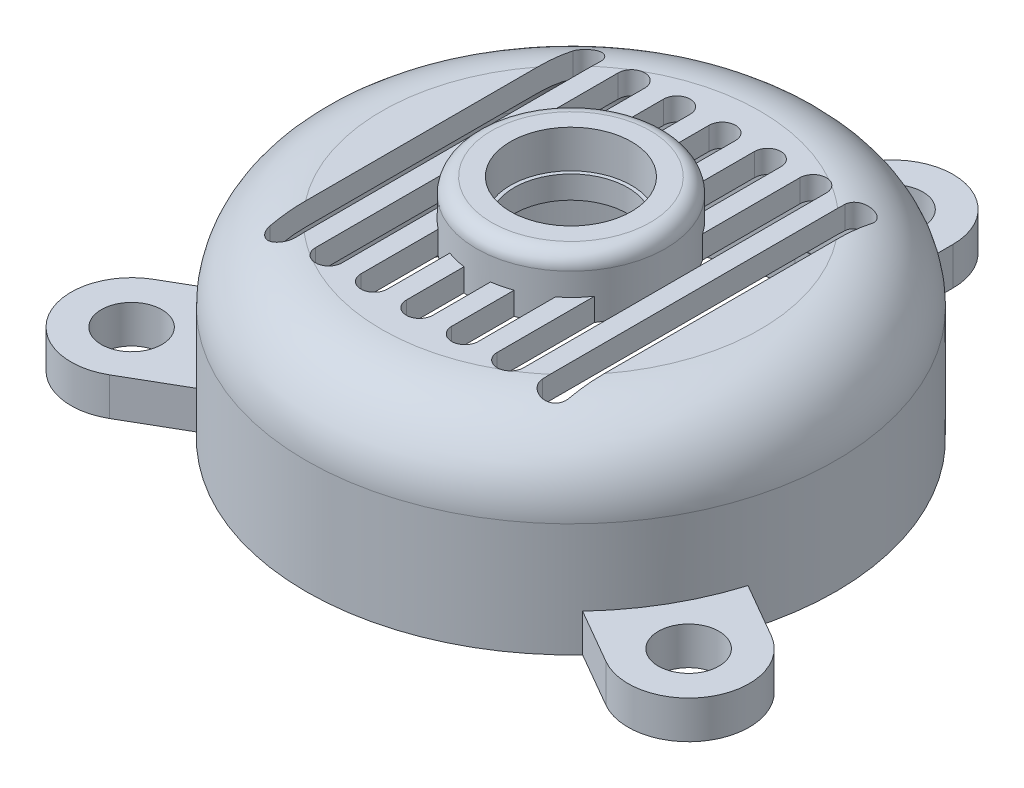
from build123d import *

# Parameters (mm, degrees)
SKETCH2_R               = 35
BOSS_EXTRUDE1_DEPTH     = 25
FILLET1_R               = 10
SHELL2_T                = -3
SKETCH3_R               = 4
BOSS_EXTRUDE2_DEPTH     = 5
SKETCH6_R               = 12.5
SKETCH6_R_2             = 7.5
BOSS_EXTRUDE3_DEPTH     = 5
FILLET2_R               = 2
CUT_EXTRUDE1_DEPTH      = 72.991907702
CUT_EXTRUDE1_DEPTH_BACK = 72.991907702
SKETCH11_R              = 8
CUT_EXTRUDE3_DEPTH      = 72.991907702
BOSS_EXTRUDE4_START     = -3
SKETCH20_R              = 12.5
SKETCH20_R_2            = 7.5
BOSS_EXTRUDE4_DEPTH     = 3


with BuildPart() as part:
    # Sketch2 → Boss-Extrude1 (new body)
    with BuildSketch(Plane(origin=(0, 0, 0), x_dir=(1, 0, 0), z_dir=(0, 1, 0))):
        with Locations(Location((0, 0, 0), (0, 0, 270))):
            Circle(SKETCH2_R)
    extrude(amount=BOSS_EXTRUDE1_DEPTH)

    # Fillet1
    fillet1_edges = [part.edges().sort_by_distance(p)[0] for p in [
        (0, 25, -35),
    ]]
    fillet(fillet1_edges, radius=FILLET1_R)

    # Shell2
    shell2_openings = [part.faces().sort_by_distance(p)[0] for p in [
        (0, 0, 0),
    ]]
    offset(amount=SHELL2_T, openings=shell2_openings, kind=Kind.INTERSECTION)

    # Sketch3 → Boss-Extrude2 (add)
    # profile 1 of 3: a face of its own
    with BuildSketch(Plane(origin=(0, 0, 0), x_dir=(1, 0, 0), z_dir=(0, 1, 0))):
        with BuildLine():
            Line((8, 42.5), (8, 31.918140877))
            Line((8, 31.918140877), (-8, 31.918140877))
            Line((-8, 31.918140877), (-8, 42.5))
            ThreePointArc((-8, 42.5), (0, 50.5), (8, 42.5))
        make_face()
        with Locations(Location((0, 42.5, 0), (0, 0, 270))):
            Circle(SKETCH3_R, mode=Mode.SUBTRACT)
    # profile 2 of 3: a face of its own
    with BuildSketch(Plane(origin=(0, 0, 0), x_dir=(1, 0, 0), z_dir=(0, 1, 0))):
        with BuildLine():
            Line((32.806079661, -28.17820323), (23.641920841, -22.887273669))
            Line((23.641920841, -22.887273669), (31.641920841, -9.030867208))
            Line((31.641920841, -9.030867208), (40.806079661, -14.32179677))
            ThreePointArc((40.806079661, -14.32179677), (43.734282891, -25.25), (32.806079661, -28.17820323))
        make_face()
        with Locations(Location((36.806079661, -21.25, 0), (0, 0, 270))):
            Circle(SKETCH3_R, mode=Mode.SUBTRACT)
    # profile 3 of 3: a face of its own
    with BuildSketch(Plane(origin=(0, 0, 0), x_dir=(1, 0, 0), z_dir=(0, 1, 0))):
        with BuildLine():
            Line((-40.806079661, -14.32179677), (-31.641920841, -9.030867208))
            Line((-31.641920841, -9.030867208), (-23.641920841, -22.887273669))
            Line((-23.641920841, -22.887273669), (-32.806079661, -28.17820323))
            ThreePointArc((-32.806079661, -28.17820323), (-43.734282891, -25.25), (-40.806079661, -14.32179677))
        make_face()
        with Locations(Location((-36.806079661, -21.25, 0), (0, 0, 270))):
            Circle(SKETCH3_R, mode=Mode.SUBTRACT)
    extrude(amount=BOSS_EXTRUDE2_DEPTH)

    # Sketch6 → Boss-Extrude3 (add)
    with BuildSketch(Plane(origin=(0, 25, 0), x_dir=(1, 0, 0), z_dir=(0, 1, 0))):
        with Locations(Location((0, 0, 0), (0, 0, 270))):
            Circle(SKETCH6_R)
        with Locations(Location((0, 0, 0), (0, 0, 270))):
            Circle(SKETCH6_R_2, mode=Mode.SUBTRACT)
    extrude(amount=BOSS_EXTRUDE3_DEPTH)

    # Fillet2
    fillet2_edges = [part.edges().sort_by_distance(p)[0] for p in [
        (0, 30, -12.5),
    ]]
    fillet(fillet2_edges, radius=FILLET2_R)

    # Sketch11 → Cut-Extrude1 (cut, two sides: drawn at the far end of the back side and taken through both)
    with BuildSketch(Plane(origin=(0, 25, 0), x_dir=(1, 0, 0), z_dir=(0, 1, 0)).offset(-CUT_EXTRUDE1_DEPTH_BACK)):
        with Locations(Location((0, 0, 0), (0, 0, 270))):
            Circle(SKETCH11_R)
    extrude(amount=CUT_EXTRUDE1_DEPTH + CUT_EXTRUDE1_DEPTH_BACK, mode=Mode.SUBTRACT)

    # Sketch18 → Cut-Extrude3 (cut, through all)
    with BuildSketch(Plane(origin=(0, 25, 0), x_dir=(1, 0, 0), z_dir=(0, 1, 0))):
        with BuildLine():
            Line((-1.75, -20), (-1.75, 20))
            ThreePointArc((-1.75, 20), (0, 21.75), (1.75, 20))
            Line((1.75, 20), (1.75, -20))
            ThreePointArc((1.75, -20), (0, -21.75), (-1.75, -20))
        make_face()
        with BuildLine():
            Line((4.25, -20), (4.25, 20))
            ThreePointArc((4.25, 20), (6, 21.75), (7.75, 20))
            Line((7.75, 20), (7.75, -20))
            ThreePointArc((7.75, -20), (6, -21.75), (4.25, -20))
        make_face()
        with BuildLine():
            Line((10.25, -20), (10.25, 20))
            ThreePointArc((10.25, 20), (12, 21.75), (13.75, 20))
            Line((13.75, 20), (13.75, -20))
            ThreePointArc((13.75, -20), (12, -21.75), (10.25, -20))
        make_face()
        with BuildLine():
            Line((16.25, -20), (16.25, 20))
            ThreePointArc((16.25, 20), (18, 21.75), (19.75, 20))
            Line((19.75, 20), (19.75, -20))
            ThreePointArc((19.75, -20), (18, -21.75), (16.25, -20))
        make_face()
        with BuildLine():
            Line((-7.75, -20), (-7.75, 20))
            ThreePointArc((-7.75, 20), (-6, 21.75), (-4.25, 20))
            Line((-4.25, 20), (-4.25, -20))
            ThreePointArc((-4.25, -20), (-6, -21.75), (-7.75, -20))
        make_face()
        with BuildLine():
            Line((-13.75, -20), (-13.75, 20))
            ThreePointArc((-13.75, 20), (-12, 21.75), (-10.25, 20))
            Line((-10.25, 20), (-10.25, -20))
            ThreePointArc((-10.25, -20), (-12, -21.75), (-13.75, -20))
        make_face()
        with BuildLine():
            Line((-19.75, -20), (-19.75, 20))
            ThreePointArc((-19.75, 20), (-18, 21.75), (-16.25, 20))
            Line((-16.25, 20), (-16.25, -20))
            ThreePointArc((-16.25, -20), (-18, -21.75), (-19.75, -20))
        make_face()
    extrude(amount=-CUT_EXTRUDE3_DEPTH, mode=Mode.SUBTRACT)

    # Sketch20 → Boss-Extrude4 (add)
    with BuildSketch(Plane(origin=(0, 25, 0), x_dir=(1, 0, 0), z_dir=(0, 1, 0)).offset(BOSS_EXTRUDE4_START)):
        with Locations(Location((0, 0, 0), (0, 0, 81.952153753))):
            Circle(SKETCH20_R)
        with Locations(Location((0, 0, 0), (0, 0, 270))):
            Circle(SKETCH20_R_2, mode=Mode.SUBTRACT)
    extrude(amount=BOSS_EXTRUDE4_DEPTH)


solid = part.part
